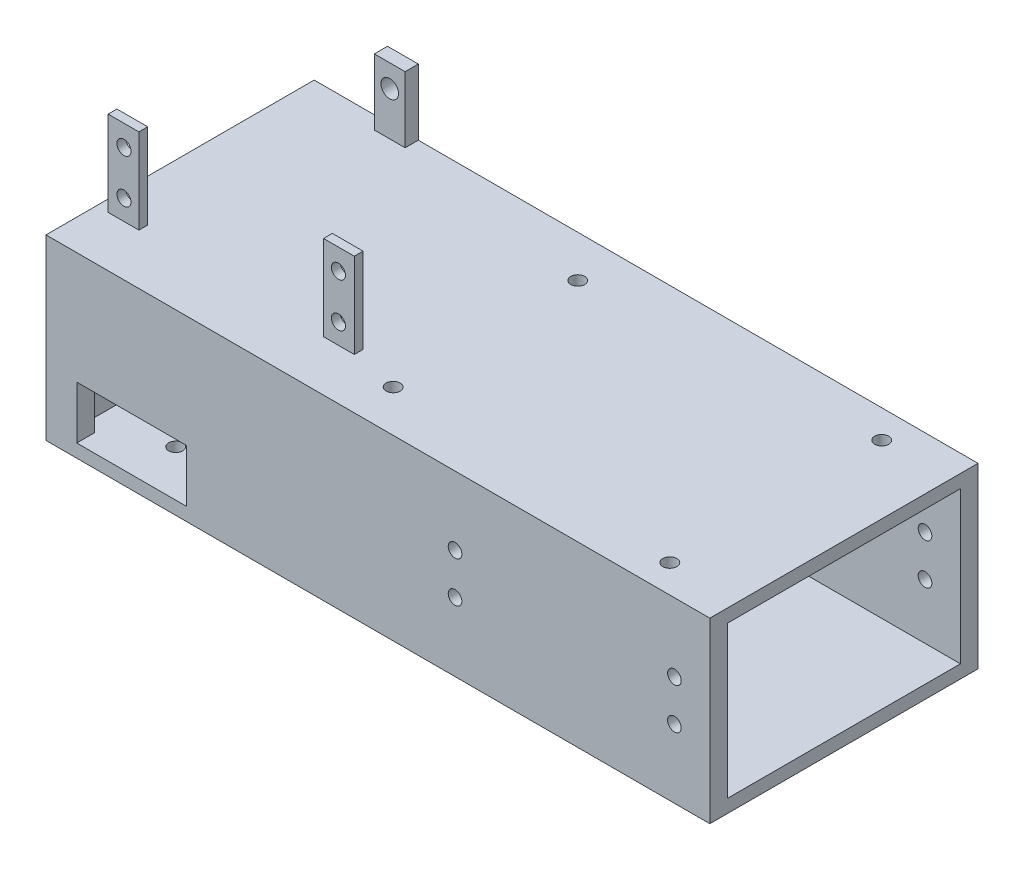
from build123d import *

# Parameters (mm, degrees)
SKETCH1_W           = 151
SKETCH1_H           = 61
SKETCH1_W_2         = 143
SKETCH1_H_2         = 53
BOSS_EXTRUDE1_DEPTH = 20.25
SKETCH2_W           = 143
SKETCH2_H           = 53
BOSS_EXTRUDE2_DEPTH = 3
SKETCH7_W           = 53
SKETCH7_H           = 37.5
CUT_EXTRUDE3_DEPTH  = 4
SKETCH9_W           = 147
SKETCH9_H           = 53
BOSS_EXTRUDE3_DEPTH = 3
CUT_EXTRUDE4_REACH  = 92.944
SKETCH10_R          = 1.6
SKETCH12_R          = 1.55
CUT_EXTRUDE6_DEPTH  = 100.152975245
SKETCH13_W          = 7
SKETCH13_H          = 19.36
BOSS_EXTRUDE4_DEPTH = 2
SKETCH16_R          = 1.6
CUT_EXTRUDE7_DEPTH  = 10
SKETCH17_W          = 7
SKETCH17_H          = 15
SKETCH17_R          = 2
BOSS_EXTRUDE5_DEPTH = 3
SKETCH18_R          = 1.6
CUT_EXTRUDE8_DEPTH  = 10
SKETCH19_W          = 25
SKETCH19_H          = 12
CUT_EXTRUDE9_DEPTH  = 105.834164756


with BuildPart() as part:
    # Sketch1 → Boss-Extrude1 (new, symmetric)
    with BuildSketch(Plane(origin=(0, 0, 0), x_dir=(1, 0, 0), z_dir=(0, 1, 0))):
        Rectangle(SKETCH1_W, SKETCH1_H)
        Rectangle(SKETCH1_W_2, SKETCH1_H_2, mode=Mode.SUBTRACT)
    extrude(amount=BOSS_EXTRUDE1_DEPTH, both=True)

    # Sketch2 → Boss-Extrude2 (add)
    with BuildSketch(Plane.XZ.offset(20.25)):
        Rectangle(SKETCH2_W, SKETCH2_H)
    extrude(amount=-BOSS_EXTRUDE2_DEPTH)

    # Sketch7 → Cut-Extrude3 (cut)
    with BuildSketch(Plane(origin=(75.5, 0, 0), x_dir=(0, 0, -1), z_dir=(1, 0, 0))):
        with Locations((0, 1.5)):
            Rectangle(SKETCH7_W, SKETCH7_H)
    extrude(amount=-CUT_EXTRUDE3_DEPTH, mode=Mode.SUBTRACT)

    # Sketch9 → Boss-Extrude3 (add)
    with BuildSketch(Plane(origin=(0, 20.25, 0), x_dir=(1, 0, 0), z_dir=(0, 1, 0))):
        with Locations((2, 0)):
            Rectangle(SKETCH9_W, SKETCH9_H)
    extrude(amount=-BOSS_EXTRUDE3_DEPTH)

    # Sketch10 → Cut-Extrude4 (cut, up to next)
    with BuildSketch(Plane(origin=(0, 20.25, 0), x_dir=(1, 0, 0), z_dir=(0, 1, 0)), mode=Mode.PRIVATE) as cut_extrude4_sk1:
        with Locations(Location((60, 24.1, 0), (0, 0, 270))):
            Circle(SKETCH10_R)
    cut_extrude4_tool1 = extrude(cut_extrude4_sk1.sketch, amount=-CUT_EXTRUDE4_REACH, mode=Mode.PRIVATE) & part.part
    # Sketch10 → Cut-Extrude4 (cut, up to next)
    with BuildSketch(Plane(origin=(0, 20.25, 0), x_dir=(1, 0, 0), z_dir=(0, 1, 0)), mode=Mode.PRIVATE) as cut_extrude4_sk2:
        with Locations(Location((60, -24.1, 0), (0, 0, 90))):
            Circle(SKETCH10_R)
    cut_extrude4_tool2 = extrude(cut_extrude4_sk2.sketch, amount=-CUT_EXTRUDE4_REACH, mode=Mode.PRIVATE) & part.part
    # Sketch10 → Cut-Extrude4 (cut, up to next)
    with BuildSketch(Plane(origin=(0, 20.25, 0), x_dir=(1, 0, 0), z_dir=(0, 1, 0)), mode=Mode.PRIVATE) as cut_extrude4_sk3:
        with Locations(Location((-6.04, 21, 0), (0, 0, 270))):
            Circle(SKETCH10_R)
    cut_extrude4_tool3 = extrude(cut_extrude4_sk3.sketch, amount=-CUT_EXTRUDE4_REACH, mode=Mode.PRIVATE) & part.part
    # Sketch10 → Cut-Extrude4 (cut, up to next)
    with BuildSketch(Plane(origin=(0, 20.25, 0), x_dir=(1, 0, 0), z_dir=(0, 1, 0)), mode=Mode.PRIVATE) as cut_extrude4_sk4:
        with Locations(Location((-6.04, -21, 0), (0, 0, 90))):
            Circle(SKETCH10_R)
    cut_extrude4_tool4 = extrude(cut_extrude4_sk4.sketch, amount=-CUT_EXTRUDE4_REACH, mode=Mode.PRIVATE) & part.part
    add(cut_extrude4_tool1.solids().sort_by_distance((60, 20.25, -24.1))[0], mode=Mode.SUBTRACT)
    add(cut_extrude4_tool2.solids().sort_by_distance((60, 20.25, 24.1))[0], mode=Mode.SUBTRACT)
    add(cut_extrude4_tool3.solids().sort_by_distance((-6.04, 20.25, -21))[0], mode=Mode.SUBTRACT)
    add(cut_extrude4_tool4.solids().sort_by_distance((-6.04, 20.25, 21))[0], mode=Mode.SUBTRACT)

    # Sketch12 → Cut-Extrude6 (cut, through all)
    with BuildSketch(Plane.XY.offset(30.5)):
        with Locations((67.445205237, 4.65)):
            Circle(SKETCH12_R)
        with Locations((67.445205237, -4.65)):
            Circle(SKETCH12_R)
        with Locations((17.545205237, 4.65)):
            Circle(SKETCH12_R)
        with Locations((17.545205237, -4.65)):
            Circle(SKETCH12_R)
    extrude(amount=-CUT_EXTRUDE6_DEPTH, mode=Mode.SUBTRACT)

    # Sketch13 → Boss-Extrude4 (add)
    with BuildSketch(Plane.XY.offset(17)):
        with Locations((-69.37, 29.93)):
            Rectangle(SKETCH13_W, SKETCH13_H)
    boss_extrude4 = extrude(amount=BOSS_EXTRUDE4_DEPTH)

    # Sketch16 → Cut-Extrude7 (cut)
    with BuildSketch(Plane.XY.offset(19)):
        with Locations((-69.262241782, 24.85)):
            Circle(SKETCH16_R)
        with Locations((-69.262241782, 34.85)):
            Circle(SKETCH16_R)
    cut_extrude7 = extrude(amount=-CUT_EXTRUDE7_DEPTH, mode=Mode.SUBTRACT)

    # Mirror1: Boss-Extrude4, Cut-Extrude7 across plane
    add(boss_extrude4.mirror(Plane(origin=(-44.87, 0, 0), x_dir=(0, 0, 1), z_dir=(1, 0, 0))))
    add(cut_extrude7.mirror(Plane(origin=(-44.87, 0, 0), x_dir=(0, 0, 1), z_dir=(1, 0, 0))), mode=Mode.SUBTRACT)

    # Sketch17 → Boss-Extrude5 (add)
    with BuildSketch(Plane(origin=(0, 0, -30.5), x_dir=(-1, 0, 0), z_dir=(0, 0, -1))):
        with Locations((55.31, 27.75)):
            Rectangle(SKETCH17_W, SKETCH17_H)
        with Locations((55.31, 30.15)):
            Circle(SKETCH17_R, mode=Mode.SUBTRACT)
    extrude(amount=-BOSS_EXTRUDE5_DEPTH)

    # Sketch18 → Cut-Extrude8 (cut)
    with BuildSketch(Plane.XZ.offset(20.25)):
        with Locations(Location((-56.5, 20, 0), (0, 0, 270))):
            Circle(SKETCH18_R)
        with Locations(Location((-56.5, -20, 0), (0, 0, 270))):
            Circle(SKETCH18_R)
    extrude(amount=-CUT_EXTRUDE8_DEPTH, mode=Mode.SUBTRACT)

    # Sketch19 → Cut-Extrude9 (cut, through all)
    with BuildSketch(Plane.XY.offset(30.5)):
        with Locations((-56, -11.25)):
            Rectangle(SKETCH19_W, SKETCH19_H)
    extrude(amount=-CUT_EXTRUDE9_DEPTH, mode=Mode.SUBTRACT)


solid = part.part
